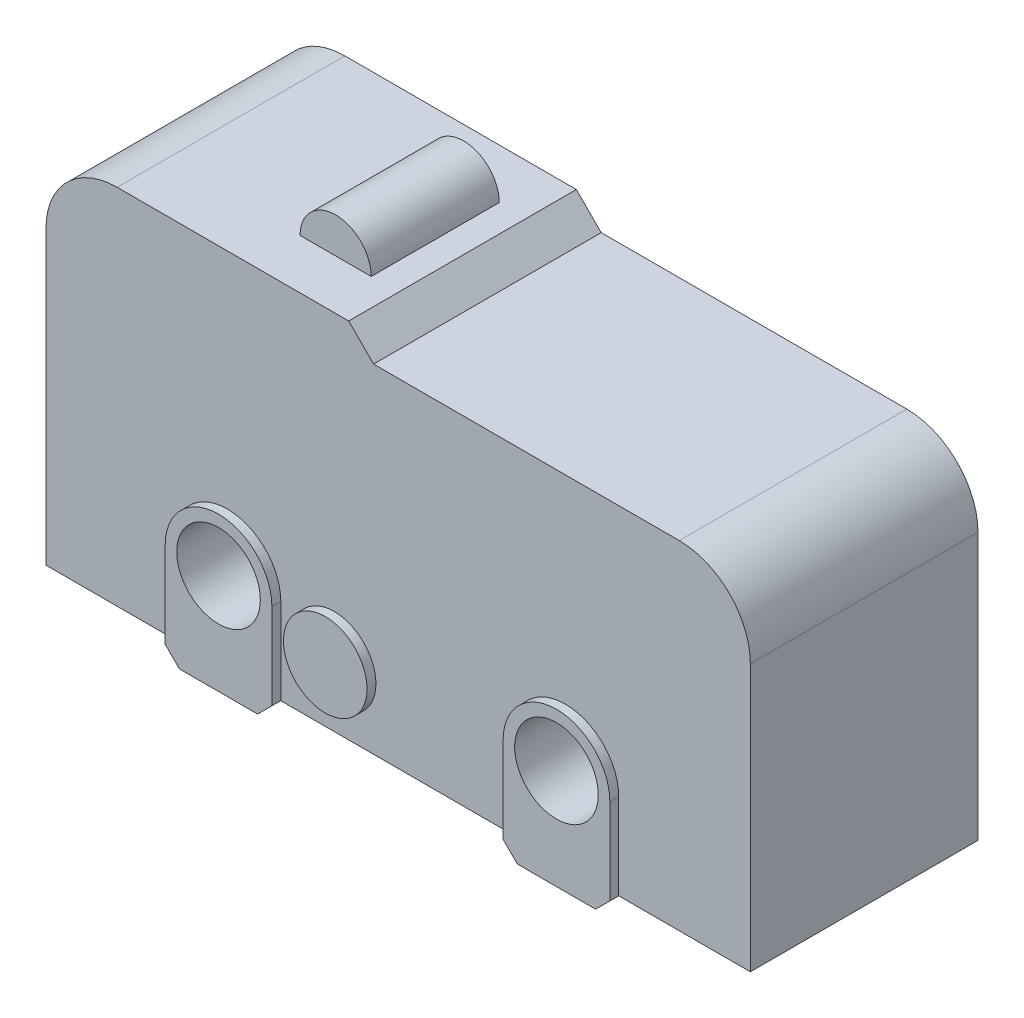
from build123d import *

# Parameters (mm, degrees)
BOSS_EXTRUDE1_DEPTH      = 6.4
SKETCH4_R                = 1.175
BOSS_EXTRUDE2_DEPTH      = 0.25
BOSS_EXTRUDE3_START      = 0.25
SKETCH5_R                = 1.175
BOSS_EXTRUDE3_DEPTH      = 0.25
SKETCH6_R                = 1.175
CUT_EXTRUDE1_DEPTH       = 16.853786636
BOSS_EXTRUDE4_DEPTH      = 1.8
BOSS_EXTRUDE4_DEPTH_BACK = 1.8


with BuildPart() as part:
    # Sketch2 → Boss-Extrude1 (new body)
    with BuildSketch(Plane.XY):
        with BuildLine():
            Line((-7.9, 10.282147184), (-1.391176502, 10.282147184))
            Line((-1.391176502, 10.282147184), (-0.691176502, 9.582147184))
            Line((-0.691176502, 9.582147184), (7.9, 9.582147184))
            ThreePointArc((7.9, 9.582147184), (9.314213562, 8.996360746), (9.9, 7.582147184))
            Line((9.9, 7.582147184), (9.9, 0.082147184))
            Line((9.9, 0.082147184), (6.2, 0.082147184))
            Line((6.2, 0.082147184), (5.8, -0.317852816))
            Line((5.8, -0.317852816), (3.6, -0.317852816))
            Line((3.6, -0.317852816), (3.2, 0.082147184))
            Line((3.2, 0.082147184), (-3.3, 0.082147184))
            Line((-3.3, 0.082147184), (-3.7, -0.317852816))
            Line((-3.7, -0.317852816), (-5.9, -0.317852816))
            Line((-5.9, -0.317852816), (-6.3, 0.082147184))
            Line((-6.3, 0.082147184), (-9.9, 0.082147184))
            Line((-9.9, 0.082147184), (-9.9, 8.282147184))
            ThreePointArc((-9.9, 8.282147184), (-9.314213562, 9.696360746), (-7.9, 10.282147184))
        make_face()
    extrude(amount=BOSS_EXTRUDE1_DEPTH)

    # Sketch4 → Boss-Extrude2 (add)
    with BuildSketch(Plane.XY.offset(6.4)):
        with Locations((-1.8, 1.832147184)):
            Circle(SKETCH4_R)
        with BuildLine():
            Line((-6.3, 2.5), (-6.3, 0.082147184))
            Line((-6.3, 0.082147184), (-5.9, -0.317852816))
            Line((-5.9, -0.317852816), (-3.7, -0.317852816))
            Line((-3.7, -0.317852816), (-3.3, 0.082147184))
            Line((-3.3, 0.082147184), (-3.3, 2.5))
            ThreePointArc((-3.3, 2.5), (-4.8, 4), (-6.3, 2.5))
        make_face()
        with BuildLine():
            Line((3.2, 2.5), (3.2, 0.082147184))
            Line((3.2, 0.082147184), (3.6, -0.317852816))
            Line((3.6, -0.317852816), (5.8, -0.317852816))
            Line((5.8, -0.317852816), (6.2, 0.082147184))
            Line((6.2, 0.082147184), (6.2, 2.5))
            ThreePointArc((6.2, 2.5), (4.7, 4), (3.2, 2.5))
        make_face()
    extrude(amount=BOSS_EXTRUDE2_DEPTH)

    # Sketch5 → Boss-Extrude3 (add)
    with BuildSketch(Plane(origin=(0, 0, 0), x_dir=(-1, 0, 0), z_dir=(0, 0, -1)).offset(BOSS_EXTRUDE3_START)):
        with Locations(Location((1.8, 1.832147184, 0), (0, 0, 180))):
            Circle(SKETCH5_R)
        with BuildLine():
            Line((6.3, 2.5), (6.3, 0.082147184))
            Line((6.3, 0.082147184), (5.9, -0.317852816))
            Line((5.9, -0.317852816), (3.7, -0.317852816))
            Line((3.7, -0.317852816), (3.3, 0.082147184))
            Line((3.3, 0.082147184), (3.3, 2.5))
            ThreePointArc((3.3, 2.5), (4.8, 4), (6.3, 2.5))
        make_face()
        with BuildLine():
            Line((-3.2, 2.5), (-3.2, 0.082147184))
            Line((-3.2, 0.082147184), (-3.6, -0.317852816))
            Line((-3.6, -0.317852816), (-5.8, -0.317852816))
            Line((-5.8, -0.317852816), (-6.2, 0.082147184))
            Line((-6.2, 0.082147184), (-6.2, 2.5))
            ThreePointArc((-6.2, 2.5), (-4.7, 4), (-3.2, 2.5))
        make_face()
    extrude(amount=-BOSS_EXTRUDE3_DEPTH)

    # Sketch6 → Cut-Extrude1 (cut, through all)
    with BuildSketch(Plane.XY.offset(6.65)):
        with Locations((-4.8, 2.5)):
            Circle(SKETCH6_R)
        with Locations((4.7, 2.5)):
            Circle(SKETCH6_R)
    extrude(amount=-CUT_EXTRUDE1_DEPTH, mode=Mode.SUBTRACT)

    # Sketch7 → Boss-Extrude4 (add, two sides: drawn at the far end of the back side and taken through both)
    with BuildSketch(Plane.XY.offset(3.2).offset(-BOSS_EXTRUDE4_DEPTH_BACK)):
        with BuildLine():
            Line((-4.158024121, 10.282147184), (-2.158024121, 10.282147184))
            ThreePointArc((-2.158024121, 10.282147184), (-3.158024121, 11.282147184), (-4.158024121, 10.282147184))
        make_face()
    extrude(amount=BOSS_EXTRUDE4_DEPTH + BOSS_EXTRUDE4_DEPTH_BACK)


solid = part.part
